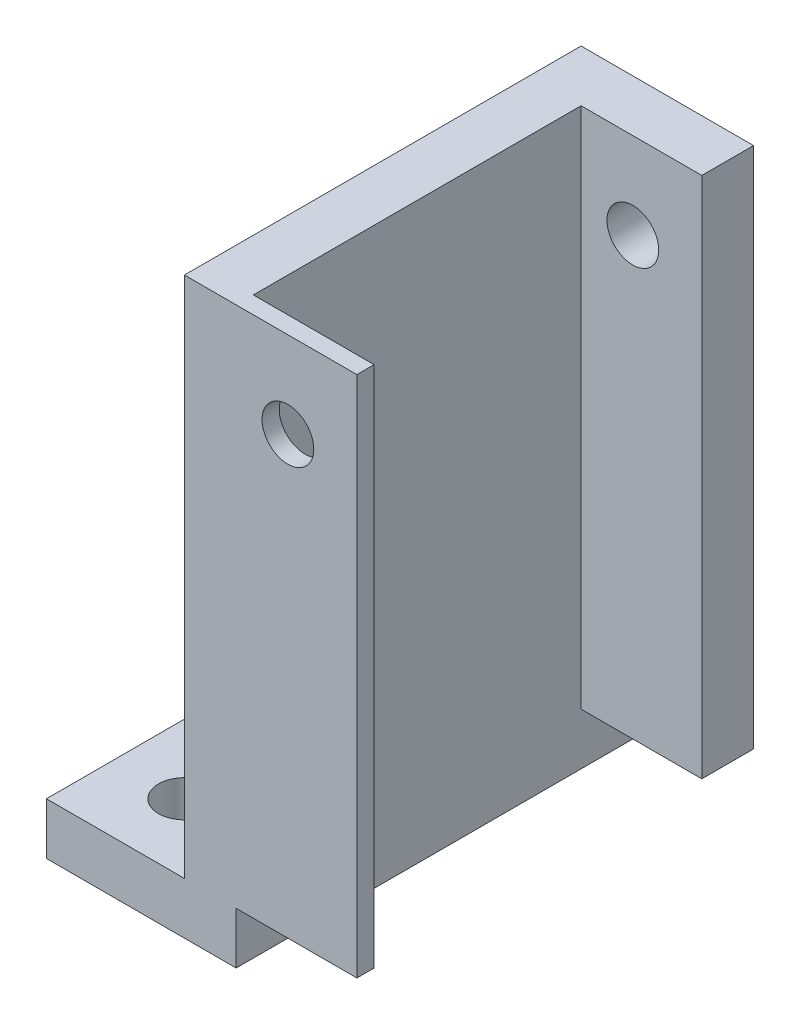
from build123d import *

# Parameters (mm, degrees)
CROQUIS1_W              = 23
CROQUIS1_H              = 30.3
SALIENTE_EXTRUIR2_DEPTH = 10
CROQUIS3_W              = 7
CROQUIS3_H              = 19
CORTAR_EXTRUIR1_DEPTH   = 40.333064971
CROQUIS4_W              = 11
CROQUIS4_H              = 23
SALIENTE_EXTRUIR3_DEPTH = 3
CROQUIS5_R              = 1.5
CORTAR_EXTRUIR3_DEPTH   = 40.333064971
CROQUIS6_R              = 1.5
CORTAR_EXTRUIR4_DEPTH   = 42.688007868
NERVIO10_REACH          = 38.622
CROQUIS23_WALL_W        = 82.243156676
CROQUIS23_WALL_H        = 7


with BuildPart() as part:
    # Croquis1 → Saliente-Extruir2 (new body)
    with BuildSketch(Plane(origin=(0, 0, 0), x_dir=(0, 0, -1), z_dir=(1, 0, 0))):
        with Locations((-11.5, -15.15)):
            Rectangle(CROQUIS1_W, CROQUIS1_H)
    extrude(amount=SALIENTE_EXTRUIR2_DEPTH)

    # Croquis3 → Cortar-Extruir1 (cut, through all)
    with BuildSketch(Plane(origin=(0, 0, 0), x_dir=(1, 0, 0), z_dir=(0, 1, 0))):
        with Locations((6.5, -12.5)):
            Rectangle(CROQUIS3_W, CROQUIS3_H)
    extrude(amount=-CORTAR_EXTRUIR1_DEPTH, mode=Mode.SUBTRACT)

    # Croquis4 → Saliente-Extruir3 (add)
    with BuildSketch(Plane.XZ.offset(30.3)):
        with Locations((-2.5, 11.5)):
            Rectangle(CROQUIS4_W, CROQUIS4_H)
    extrude(amount=SALIENTE_EXTRUIR3_DEPTH)

    # Croquis5 → Cortar-Extruir3 (cut, through all)
    with BuildSketch(Plane(origin=(0, -30.3, 0), x_dir=(1, 0, 0), z_dir=(0, 1, 0))):
        with Locations(Location((-4, -4, 0), (0, 0, 270))):
            Circle(CROQUIS5_R)
        with Locations(Location((-4, -19, 0), (0, 0, 270))):
            Circle(CROQUIS5_R)
    extrude(amount=-CORTAR_EXTRUIR3_DEPTH, mode=Mode.SUBTRACT)

    # Croquis6 → Cortar-Extruir4 (cut, through all)
    with BuildSketch(Plane.XY.offset(23)):
        with Locations(Location((6, -5, 0), (0, 0, 270))):
            Circle(CROQUIS6_R)
    extrude(amount=-CORTAR_EXTRUIR4_DEPTH, mode=Mode.SUBTRACT)

    # Croquis23 wall → Nervio10 (add, up to next)
    with BuildSketch(Plane(origin=(-2.474873734, -27.825126266, 11.5), x_dir=(0.707106781187, 0.707106781187, 0), z_dir=(-0.707106781187, 0.707106781187, 0)), mode=Mode.PRIVATE) as nervio10_sk1:
        Rectangle(CROQUIS23_WALL_W, CROQUIS23_WALL_H)
    nervio10_tool1 = extrude(nervio10_sk1.sketch, amount=-NERVIO10_REACH, mode=Mode.PRIVATE) - part.part
    add(nervio10_tool1.solids().sort_by_distance((-2.474873734, -27.825126266, 11.5))[0])


solid = part.part
